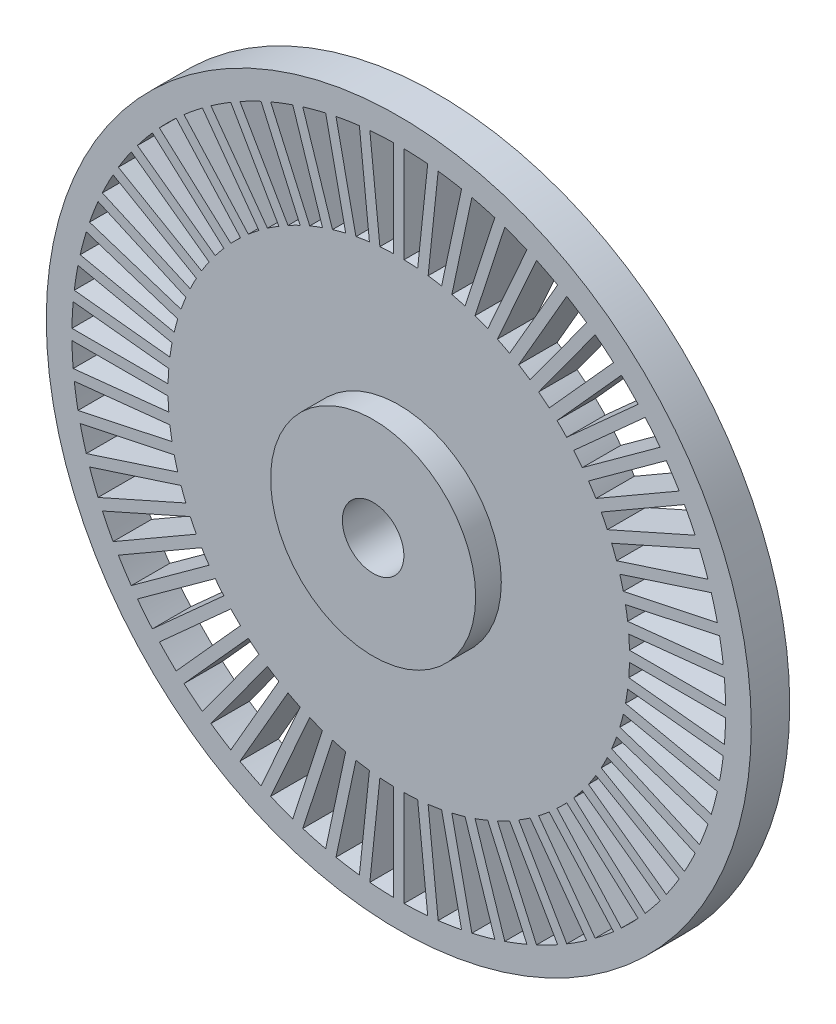
from build123d import *

# Parameters (mm, degrees)
SZKIC1_R                    = 13.75
SZKIC1_R_2                  = 1.2
DODANIE_WYCI_GNI_CIE1_DEPTH = 1.5
SZKIC2_R                    = 12.75
SZKIC2_R_2                  = 9
WYTNIJ_WYCI_GNI_CIE1_DEPTH  = 1.5
SZKIC3_W                    = 0.41
SZKIC3_H                    = 4.755901709
DODANIE_WYCI_GNI_CIE2_DEPTH = 1.5
SZYK_KO_OWY1_COUNT          = 60
SZKIC4_R                    = 4
SZKIC4_R_2                  = 1.2
DODANIE_WYCI_GNI_CIE3_DEPTH = 1


with BuildPart() as part:
    # Szkic1 → Dodanie-wyciągnięcie1 (new body)
    with BuildSketch(Plane.XY):
        Circle(SZKIC1_R)
        Circle(SZKIC1_R_2, mode=Mode.SUBTRACT)
    extrude(amount=DODANIE_WYCI_GNI_CIE1_DEPTH)

    # Szkic2 → Wytnij-wyciągnięcie1 (cut)
    with BuildSketch(Plane(origin=(0, 0, 0), x_dir=(-1, 0, 0), z_dir=(0, 0, -1))):
        Circle(SZKIC2_R)
        Circle(SZKIC2_R_2, mode=Mode.SUBTRACT)
    extrude(amount=-WYTNIJ_WYCI_GNI_CIE1_DEPTH, mode=Mode.SUBTRACT)


with BuildPart() as wytnij_wyci_gni_cie1_piece_1:
    # of the separate pieces the step leaves, piece 1, a body of its own (wytnij_wyci_gni_cie1_pieces)
    add(part.part.solids().sort_by_distance((-9, 0, 0))[0])



with BuildPart() as wytnij_wyci_gni_cie1_piece_2:
    # of the separate pieces the step leaves, piece 2, a body of its own (wytnij_wyci_gni_cie1_pieces)
    add(part.part.solids().sort_by_distance((13.75, 0, 0))[0])


with BuildPart() as wytnij_wyci_gni_cie1_piece_1_1:
    add(wytnij_wyci_gni_cie1_piece_1.part)

    add(wytnij_wyci_gni_cie1_piece_2.part)  # Dodanie-wyciągnięcie2 merges Wytnij-wyciągnięcie1 piece 2
    # Szkic3 → Dodanie-wyciągnięcie2 (add)
    with BuildSketch(Plane.XY.offset(1.5)):
        with Locations((0, 10.521706152)):
            Rectangle(SZKIC3_W, SZKIC3_H)
    dodanie_wyci_gni_cie2 = extrude(amount=-DODANIE_WYCI_GNI_CIE2_DEPTH)

    # Szyk kołowy1: Dodanie-wyciągnięcie2 ×60 about axis
    szyk_ko_owy1_axis = Axis((0, 0, 0), (0, 0, 1))
    for i in range(1, SZYK_KO_OWY1_COUNT):
        add(dodanie_wyci_gni_cie2.rotate(szyk_ko_owy1_axis, i * 360 / SZYK_KO_OWY1_COUNT))

    # Szkic4 → Dodanie-wyciągnięcie3 (add)
    with BuildSketch(Plane.XY.offset(1.5)):
        Circle(SZKIC4_R)
        Circle(SZKIC4_R_2, mode=Mode.SUBTRACT)
    extrude(amount=DODANIE_WYCI_GNI_CIE3_DEPTH)


solid = wytnij_wyci_gni_cie1_piece_1_1.part
